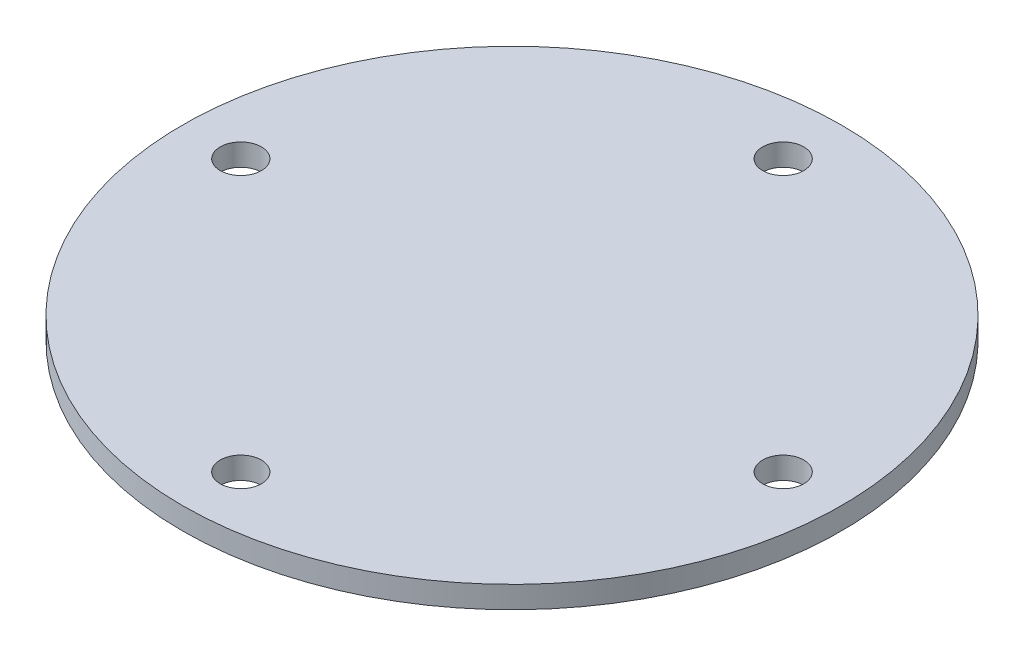
from build123d import *

# Parameters (mm, degrees)
SKETCH1_R           = 24
SKETCH1_R_2         = 1.5
BOSS_EXTRUDE1_DEPTH = 0.8


with BuildPart() as part:
    # Sketch1 → Boss-Extrude1 (new, symmetric)
    with BuildSketch(Plane(origin=(0, 0, 0), x_dir=(1, 0, 0), z_dir=(0, 1, 0))):
        with Locations(Location((0, 0, 0), (0, 0, 270))):
            Circle(SKETCH1_R)
        with Locations(Location((-19.75, 0, 0), (0, 0, 270))):
            Circle(SKETCH1_R_2, mode=Mode.SUBTRACT)
        with Locations(Location((0, -19.75, 0), (0, 0, 270))):
            Circle(SKETCH1_R_2, mode=Mode.SUBTRACT)
        with Locations(Location((19.75, 0, 0), (0, 0, 270))):
            Circle(SKETCH1_R_2, mode=Mode.SUBTRACT)
        with Locations(Location((0, 19.75, 0), (0, 0, 270))):
            Circle(SKETCH1_R_2, mode=Mode.SUBTRACT)
    extrude(amount=BOSS_EXTRUDE1_DEPTH, both=True)


solid = part.part
